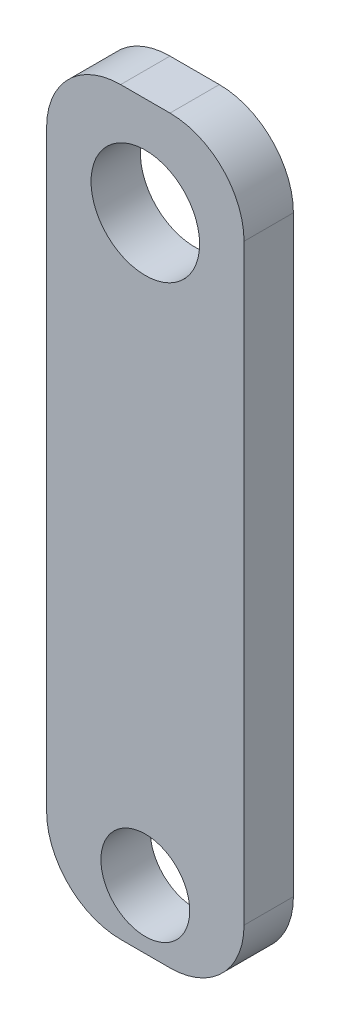
from build123d import *

# Parameters (mm, degrees)
SKIZZE1_W                       = 40
SKIZZE1_H                       = 10
AUFSATZ_LINEAR_AUSTRAGEN1_DEPTH = 150
SKIZZE2_R                       = 11
SCHNITT_LINEAR_AUSTRAGEN1_DEPTH = 152.657508881
SKIZZE3_R                       = 9
SCHNITT_LINEAR_AUSTRAGEN5_DEPTH = 152.657508881
VERRUNDUNG1_R                   = 15


with BuildPart() as part:
    # Skizze1 → Aufsatz-Linear austragen1 (new body)
    with BuildSketch(Plane(origin=(0, 0, 0), x_dir=(1, 0, 0), z_dir=(0, 1, 0))):
        Rectangle(SKIZZE1_W, SKIZZE1_H)
    extrude(amount=AUFSATZ_LINEAR_AUSTRAGEN1_DEPTH)

    # Skizze2 → Schnitt-Linear austragen1 (cut, through all)
    with BuildSketch(Plane.XY.offset(5)):
        with Locations((0, 130)):
            Circle(SKIZZE2_R)
    extrude(amount=-SCHNITT_LINEAR_AUSTRAGEN1_DEPTH, mode=Mode.SUBTRACT)

    # Skizze3 → Schnitt-Linear austragen5 (cut, through all)
    with BuildSketch(Plane.XY.offset(5)):
        with Locations((0, 12)):
            Circle(SKIZZE3_R)
    extrude(amount=-SCHNITT_LINEAR_AUSTRAGEN5_DEPTH, mode=Mode.SUBTRACT)

    # Verrundung1
    verrundung1_edges = [part.edges().sort_by_distance(p)[0] for p in [
        (-20, 150, 0),
        (20, 150, 0),
        (-20, 0, 0),
        (20, 0, 0),
    ]]
    fillet(verrundung1_edges, radius=VERRUNDUNG1_R)


solid = part.part
